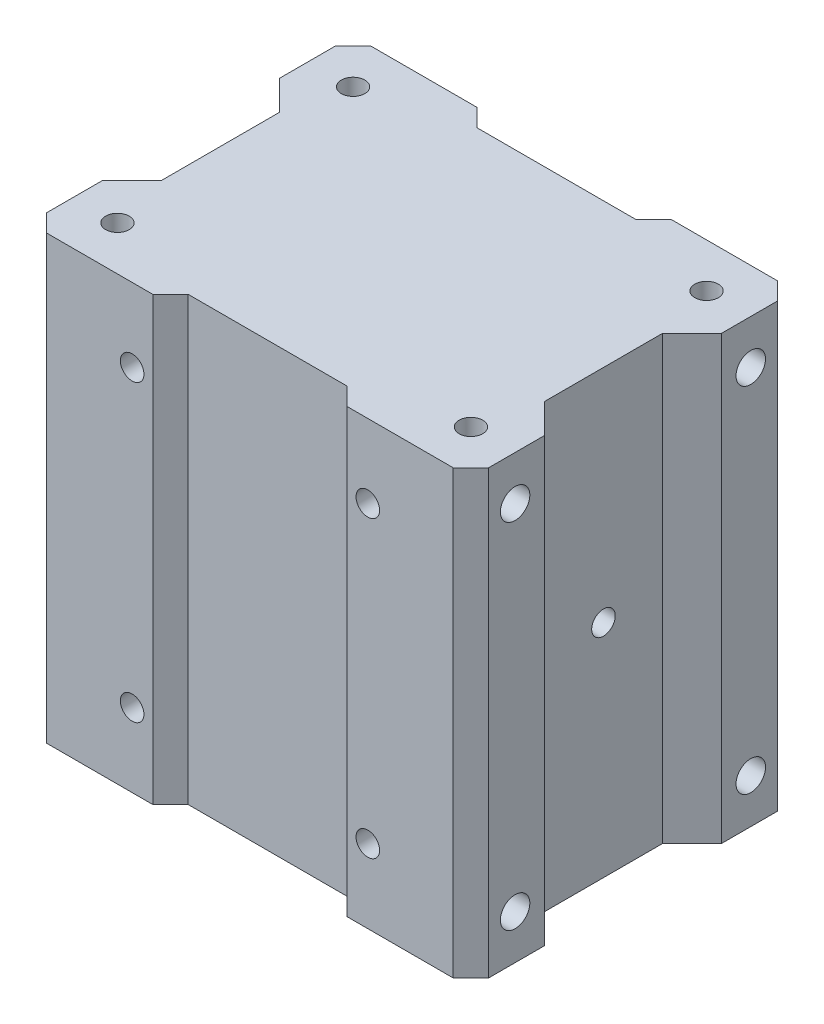
from build123d import *

# Parameters (mm, degrees)
SKETCH1_R               = 2
BOSS_EXTRUDE1_DEPTH     = 37.5
CUT_EXTRUDE1_DEPTH      = 77.40353395
CUT_EXTRUDE1_DEPTH_BACK = 35
SKETCH3_R               = 12.75
CHAMFER1_SIZE           = 3
SKETCH4_R               = 2
CUT_EXTRUDE2_DEPTH      = 85.03868157
SKETCH5_R               = 2.5
CUT_EXTRUDE4_DEPTH      = 89.246812974
SKETCH6_R               = 2
CUT_EXTRUDE5_DEPTH      = 77.403534048


with BuildPart() as part:
    # Sketch1 → Boss-Extrude1 (new, symmetric)
    with BuildSketch(Plane(origin=(0, 0, 0), x_dir=(1, 0, 0), z_dir=(0, 1, 0))):
        Polygon((-37.5, -27.5), (-16.5, -27.5), (-13.5, -24.5), (13.5, -24.5), (16.5, -27.5), (37.5, -27.5), (37.5, -15), (32.5, -10), (32.5, 10), (37.5, 15), (37.5, 27.5), (16.5, 27.5), (13.5, 24.5), (-13.5, 24.5), (-16.5, 27.5), (-37.5, 27.5), (-37.5, 15), (-32.5, 10), (-32.5, -10), (-37.5, -15), align=None)
        with Locations(Location((30, 20, 0), (0, 0, 270))):
            Circle(SKETCH1_R, mode=Mode.SUBTRACT)
        with Locations(Location((-30, 20, 0), (0, 0, 270))):
            Circle(SKETCH1_R, mode=Mode.SUBTRACT)
        with Locations(Location((-30, -20, 0), (0, 0, 270))):
            Circle(SKETCH1_R, mode=Mode.SUBTRACT)
        with Locations(Location((30, -20, 0), (0, 0, 270))):
            Circle(SKETCH1_R, mode=Mode.SUBTRACT)
    extrude(amount=BOSS_EXTRUDE1_DEPTH, both=True)

    # Sketch3 → Cut-Extrude1 (cut, two sides: drawn at the far end of the back side and taken through both)
    with BuildSketch(Plane(origin=(0, 0, -27.5), x_dir=(-1, 0, 0), z_dir=(0, 0, -1)).offset(-CUT_EXTRUDE1_DEPTH_BACK)):
        with Locations(Location((0, 0, 0), (0, 0, 180))):
            Circle(SKETCH3_R)
    extrude(amount=CUT_EXTRUDE1_DEPTH + CUT_EXTRUDE1_DEPTH_BACK, mode=Mode.SUBTRACT)

    # Chamfer1
    chamfer1_edges = [part.edges().sort_by_distance(p)[0] for p in [
        (37.5, 0, -27.5),
        (37.5, 0, 27.5),
        (-37.5, 0, 27.5),
        (-37.5, 0, -27.5),
    ]]
    chamfer(chamfer1_edges, length=CHAMFER1_SIZE)

    # Sketch4 → Cut-Extrude2 (cut, through all)
    with BuildSketch(Plane.ZY.offset(32.5)):
        Circle(SKETCH4_R)
    extrude(amount=-CUT_EXTRUDE2_DEPTH, mode=Mode.SUBTRACT)

    # Sketch5 → Cut-Extrude4 (cut, through all)
    with BuildSketch(Plane.ZY.offset(37.5)):
        with Locations((-20, 30)):
            Circle(SKETCH5_R)
        with Locations((-20, -30)):
            Circle(SKETCH5_R)
        with Locations((20, -30)):
            Circle(SKETCH5_R)
        with Locations((20, 30)):
            Circle(SKETCH5_R)
    extrude(amount=-CUT_EXTRUDE4_DEPTH, mode=Mode.SUBTRACT)

    # Sketch6 → Cut-Extrude5 (cut, through all)
    with BuildSketch(Plane(origin=(0, 0, -27.5), x_dir=(-1, 0, 0), z_dir=(0, 0, -1))):
        with Locations((-20, 25)):
            Circle(SKETCH6_R)
        with Locations((20, 25)):
            Circle(SKETCH6_R)
        with Locations((-20, -25)):
            Circle(SKETCH6_R)
        with Locations((20, -25)):
            Circle(SKETCH6_R)
    extrude(amount=-CUT_EXTRUDE5_DEPTH, mode=Mode.SUBTRACT)


solid = part.part
